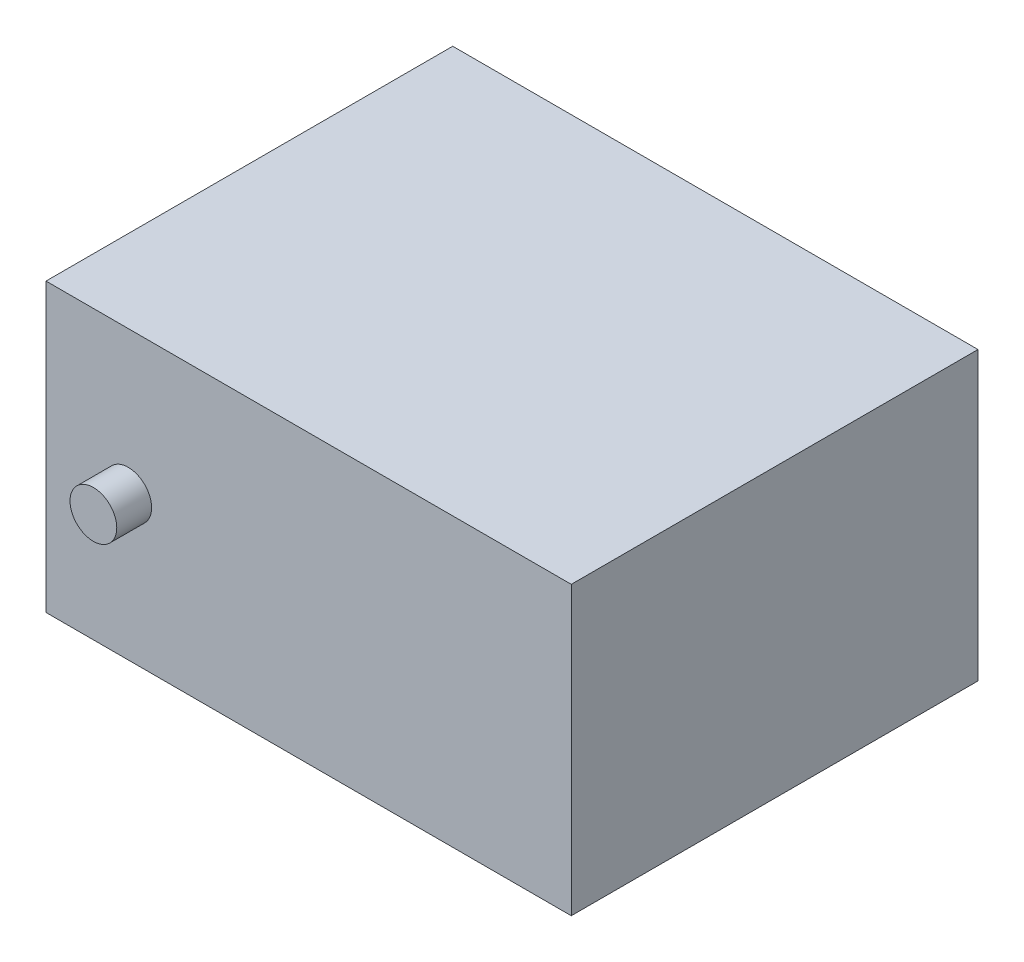
from build123d import *

# Parameters (mm, degrees)
SKETCH1_W           = 45.2
SKETCH1_H           = 24.7
BOSS_EXTRUDE1_DEPTH = 35
SKETCH2_R           = 2.010319626
BOSS_EXTRUDE2_DEPTH = 3


with BuildPart() as part:
    # Sketch1 → Boss-Extrude1 (new body)
    with BuildSketch(Plane.XY):
        Rectangle(SKETCH1_W, SKETCH1_H)
    extrude(amount=BOSS_EXTRUDE1_DEPTH)

    # Sketch2 → Boss-Extrude2 (add)
    with BuildSketch(Plane.XY.offset(35)):
        with Locations(Location((-15.521537577, 0, 0), (0, 0, 180))):
            Circle(SKETCH2_R)
    extrude(amount=BOSS_EXTRUDE2_DEPTH)


solid = part.part
